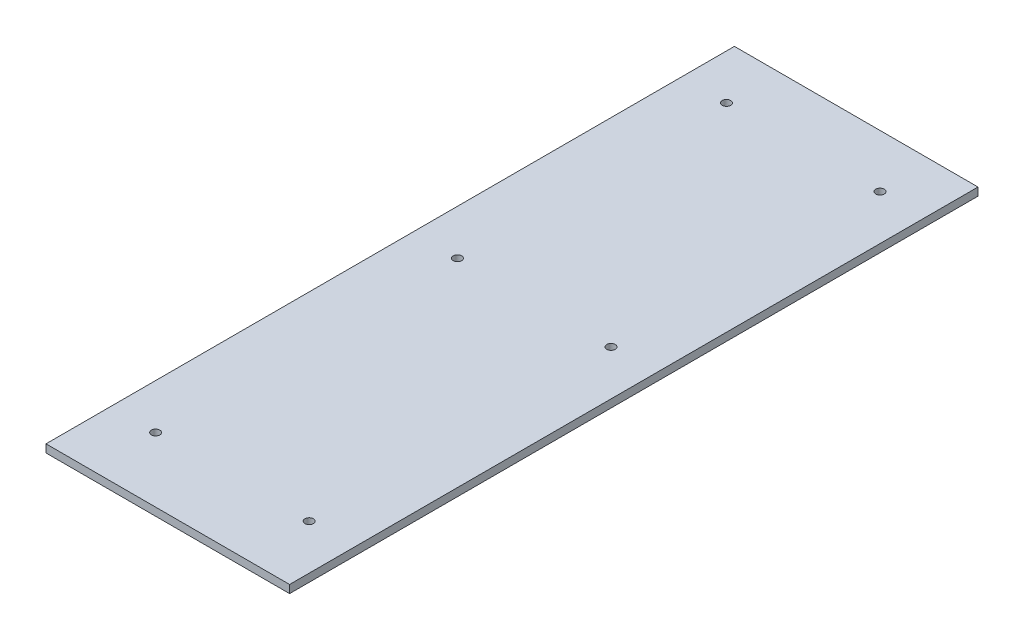
from build123d import *

# Parameters (mm, degrees)
ESQUISSE1_W             = 92
ESQUISSE1_H             = 260
BOSS_EXTRU_1_DEPTH      = 3
ENL_V_MAT_EXTRU_1_REACH = 232.148
ESQUISSE2_R             = 1.6


with BuildPart() as part:
    # Esquisse1 → Boss.-Extru.1 (new body)
    with BuildSketch(Plane(origin=(0, 0, 0), x_dir=(1, 0, 0), z_dir=(0, 1, 0))):
        with Locations((11.0745208, -92.938790058)):
            Rectangle(ESQUISSE1_W, ESQUISSE1_H)
    extrude(amount=BOSS_EXTRU_1_DEPTH)

    # Esquisse2 → Enlèv. mat.-Extru.1 (cut, up to next)
    with BuildSketch(Plane(origin=(0, 3, 0), x_dir=(1, 0, 0), z_dir=(0, 1, 0)), mode=Mode.PRIVATE) as enl_v_mat_extru_1_sk1:
        with Locations(Location((-17.9254792, -198.538790058, 0), (0, 0, 270))):
            Circle(ESQUISSE2_R)
    enl_v_mat_extru_1_tool1 = extrude(enl_v_mat_extru_1_sk1.sketch, amount=-ENL_V_MAT_EXTRU_1_REACH, mode=Mode.PRIVATE) & part.part
    # Esquisse2 → Enlèv. mat.-Extru.1 (cut, up to next)
    with BuildSketch(Plane(origin=(0, 3, 0), x_dir=(1, 0, 0), z_dir=(0, 1, 0)), mode=Mode.PRIVATE) as enl_v_mat_extru_1_sk2:
        with Locations(Location((40.0745208, -198.538790058, 0), (0, 0, 270))):
            Circle(ESQUISSE2_R)
    enl_v_mat_extru_1_tool2 = extrude(enl_v_mat_extru_1_sk2.sketch, amount=-ENL_V_MAT_EXTRU_1_REACH, mode=Mode.PRIVATE) & part.part
    # Esquisse2 → Enlèv. mat.-Extru.1 (cut, up to next)
    with BuildSketch(Plane(origin=(0, 3, 0), x_dir=(1, 0, 0), z_dir=(0, 1, 0)), mode=Mode.PRIVATE) as enl_v_mat_extru_1_sk3:
        with Locations(Location((-17.9254792, -84.538790058, 0), (0, 0, 270))):
            Circle(ESQUISSE2_R)
    enl_v_mat_extru_1_tool3 = extrude(enl_v_mat_extru_1_sk3.sketch, amount=-ENL_V_MAT_EXTRU_1_REACH, mode=Mode.PRIVATE) & part.part
    # Esquisse2 → Enlèv. mat.-Extru.1 (cut, up to next)
    with BuildSketch(Plane(origin=(0, 3, 0), x_dir=(1, 0, 0), z_dir=(0, 1, 0)), mode=Mode.PRIVATE) as enl_v_mat_extru_1_sk4:
        with Locations(Location((40.0745208, -84.538790058, 0), (0, 0, 270))):
            Circle(ESQUISSE2_R)
    enl_v_mat_extru_1_tool4 = extrude(enl_v_mat_extru_1_sk4.sketch, amount=-ENL_V_MAT_EXTRU_1_REACH, mode=Mode.PRIVATE) & part.part
    # Esquisse2 → Enlèv. mat.-Extru.1 (cut, up to next)
    with BuildSketch(Plane(origin=(0, 3, 0), x_dir=(1, 0, 0), z_dir=(0, 1, 0)), mode=Mode.PRIVATE) as enl_v_mat_extru_1_sk5:
        with Locations(Location((-17.9254792, 17.061209942, 0), (0, 0, 270))):
            Circle(ESQUISSE2_R)
    enl_v_mat_extru_1_tool5 = extrude(enl_v_mat_extru_1_sk5.sketch, amount=-ENL_V_MAT_EXTRU_1_REACH, mode=Mode.PRIVATE) & part.part
    # Esquisse2 → Enlèv. mat.-Extru.1 (cut, up to next)
    with BuildSketch(Plane(origin=(0, 3, 0), x_dir=(1, 0, 0), z_dir=(0, 1, 0)), mode=Mode.PRIVATE) as enl_v_mat_extru_1_sk6:
        with Locations(Location((40.0745208, 17.061209942, 0), (0, 0, 270))):
            Circle(ESQUISSE2_R)
    enl_v_mat_extru_1_tool6 = extrude(enl_v_mat_extru_1_sk6.sketch, amount=-ENL_V_MAT_EXTRU_1_REACH, mode=Mode.PRIVATE) & part.part
    add(enl_v_mat_extru_1_tool1.solids().sort_by_distance((-17.925479, 3, 198.53879))[0], mode=Mode.SUBTRACT)
    add(enl_v_mat_extru_1_tool2.solids().sort_by_distance((40.074521, 3, 198.53879))[0], mode=Mode.SUBTRACT)
    add(enl_v_mat_extru_1_tool3.solids().sort_by_distance((-17.925479, 3, 84.53879))[0], mode=Mode.SUBTRACT)
    add(enl_v_mat_extru_1_tool4.solids().sort_by_distance((40.074521, 3, 84.53879))[0], mode=Mode.SUBTRACT)
    add(enl_v_mat_extru_1_tool5.solids().sort_by_distance((-17.925479, 3, -17.06121))[0], mode=Mode.SUBTRACT)
    add(enl_v_mat_extru_1_tool6.solids().sort_by_distance((40.074521, 3, -17.06121))[0], mode=Mode.SUBTRACT)


solid = part.part
